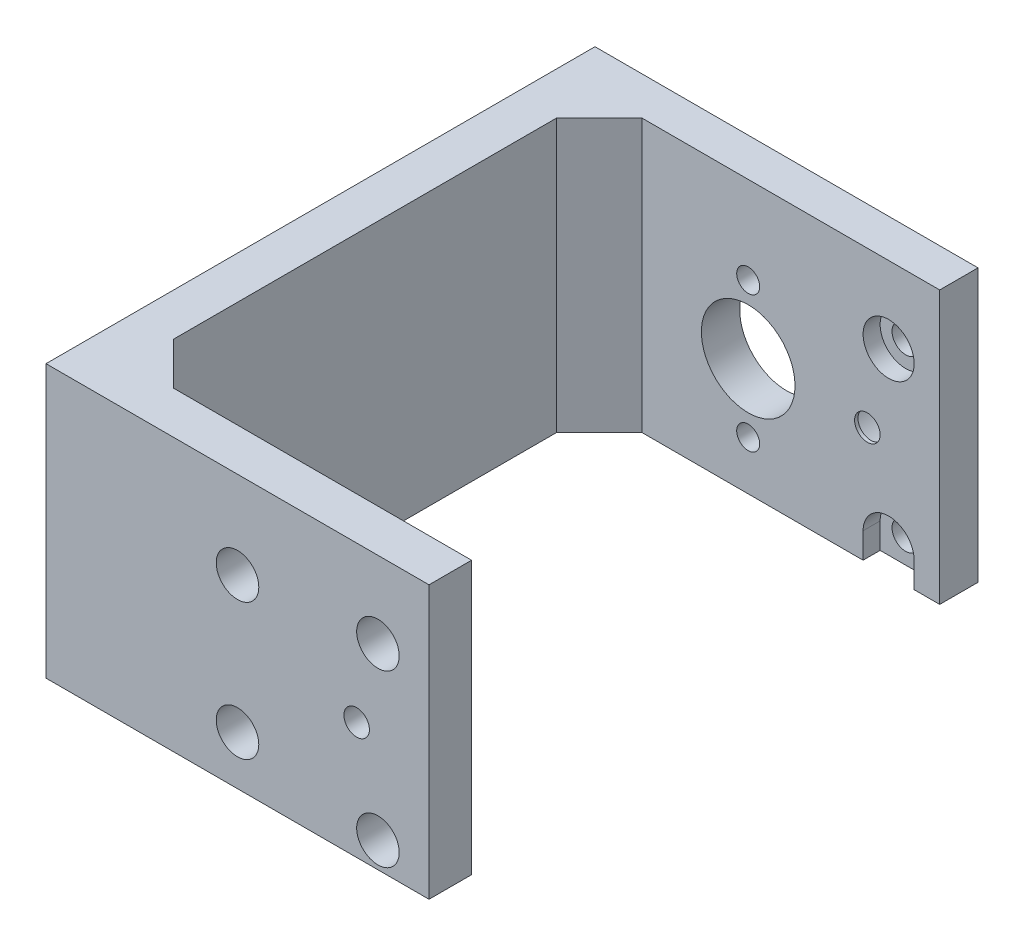
from build123d import *

# Parameters (mm, degrees)
SKETCH1_R           = 5.5
SKETCH1_R_2         = 4.45
BOSS_EXTRUDE1_DEPTH = 4.5
BOSS_EXTRUDE2_START = -0.4
SKETCH2_R           = 4.45
SKETCH2_R_2         = 1.5
BOSS_EXTRUDE2_DEPTH = 0.4
SKETCH3_R           = 1.6
CUT_EXTRUDE1_DEPTH  = 10
SKETCH4_R           = 1.35
CUT_EXTRUDE2_DEPTH  = 10
SKETCH5_W           = 45
SKETCH5_H           = 4.5
BOSS_EXTRUDE3_DEPTH = 4.5
SKETCH6_R           = 3
CUT_EXTRUDE4_DEPTH  = 2
SKETCH7_W           = 5
SKETCH7_H           = 32
BOSS_EXTRUDE4_DEPTH = 60
SKETCH8_W           = 5
SKETCH8_H           = 32
BOSS_EXTRUDE5_DEPTH = 40
CUT_EXTRUDE5_START  = -5
SKETCH11_R          = 2.5
SKETCH11_R_2        = 1.5
CUT_EXTRUDE5_DEPTH  = 5
CHAMFER1_SIZE       = 5


with BuildPart() as part:
    # Sketch1 → Boss-Extrude1 (new body)
    with BuildSketch(Plane.XY):
        Polygon((0, 27.5), (32.5, 27.5), (32.5, 0), (0, 0), (-12.5, 0), (-12.5, 27.5), align=None)
        with Locations((10, 13.75)):
            Circle(SKETCH1_R, mode=Mode.SUBTRACT)
        with Locations((24, 13.75)):
            Circle(SKETCH1_R_2, mode=Mode.SUBTRACT)
    extrude(amount=BOSS_EXTRUDE1_DEPTH)

    # Sketch2 → Boss-Extrude2 (add)
    with BuildSketch(Plane.XY.offset(4.5).offset(BOSS_EXTRUDE2_START)):
        with Locations((24, 13.75)):
            Circle(SKETCH2_R)
        with Locations((24, 13.75)):
            Circle(SKETCH2_R_2, mode=Mode.SUBTRACT)
    extrude(amount=BOSS_EXTRUDE2_DEPTH)

    # Sketch3 → Cut-Extrude1 (cut)
    with BuildSketch(Plane.XY.offset(4.5)):
        with Locations((26.5, 23)):
            Circle(SKETCH3_R)
        with Locations((26.5, 3)):
            Circle(SKETCH3_R)
    extrude(amount=-CUT_EXTRUDE1_DEPTH, mode=Mode.SUBTRACT)

    # Sketch4 → Cut-Extrude2 (cut)
    with BuildSketch(Plane.XY.offset(4.5)):
        with Locations((10, 21.75)):
            Circle(SKETCH4_R)
        with Locations((10, 5.75)):
            Circle(SKETCH4_R)
    extrude(amount=-CUT_EXTRUDE2_DEPTH, mode=Mode.SUBTRACT)

    # Sketch5 → Boss-Extrude3 (add)
    with BuildSketch(Plane.XY.offset(4.5)):
        with Locations((10, 29.75)):
            Rectangle(SKETCH5_W, SKETCH5_H)
    extrude(amount=-BOSS_EXTRUDE3_DEPTH)

    # Sketch6 → Cut-Extrude4 (cut)
    with BuildSketch(Plane.XY.offset(4.5)):
        with Locations((26.5, 23)):
            Circle(SKETCH6_R)
        with BuildLine():
            Line((23.5, 3), (23.5, 0))
            Line((23.5, 0), (29.5, 0))
            Line((29.5, 0), (29.5, 3))
            ThreePointArc((29.5, 3), (26.5, 6), (23.5, 3))
        make_face()
    extrude(amount=-CUT_EXTRUDE4_DEPTH, mode=Mode.SUBTRACT)

    # Sketch7 → Boss-Extrude4 (add)
    with BuildSketch(Plane.XY.offset(4.5)):
        with Locations((-10, 16)):
            Rectangle(SKETCH7_W, SKETCH7_H)
    extrude(amount=BOSS_EXTRUDE4_DEPTH)

    # Sketch8 → Boss-Extrude5 (add)
    with BuildSketch(Plane(origin=(-7.5, 0, 0), x_dir=(0, 0, -1), z_dir=(1, 0, 0))):
        with Locations((-62, 16)):
            Rectangle(SKETCH8_W, SKETCH8_H)
    extrude(amount=BOSS_EXTRUDE5_DEPTH)

    # Sketch11 → Cut-Extrude5 (cut)
    with BuildSketch(Plane.XY.offset(64.5).offset(CUT_EXTRUDE5_START)):
        with Locations((10, 21.75)):
            Circle(SKETCH11_R)
        with Locations((26.5, 23)):
            Circle(SKETCH11_R)
        with Locations((26.5, 3)):
            Circle(SKETCH11_R)
        with Locations((10, 5.75)):
            Circle(SKETCH11_R)
        with Locations((24, 13.75)):
            Circle(SKETCH11_R_2)
    extrude(amount=CUT_EXTRUDE5_DEPTH, mode=Mode.SUBTRACT)

    # Chamfer1
    chamfer1_edges = [part.edges().sort_by_distance(p)[0] for p in [
        (-7.5, 16, 59.5),
        (-7.5, 16, 4.5),
    ]]
    chamfer(chamfer1_edges, length=CHAMFER1_SIZE)


solid = part.part
